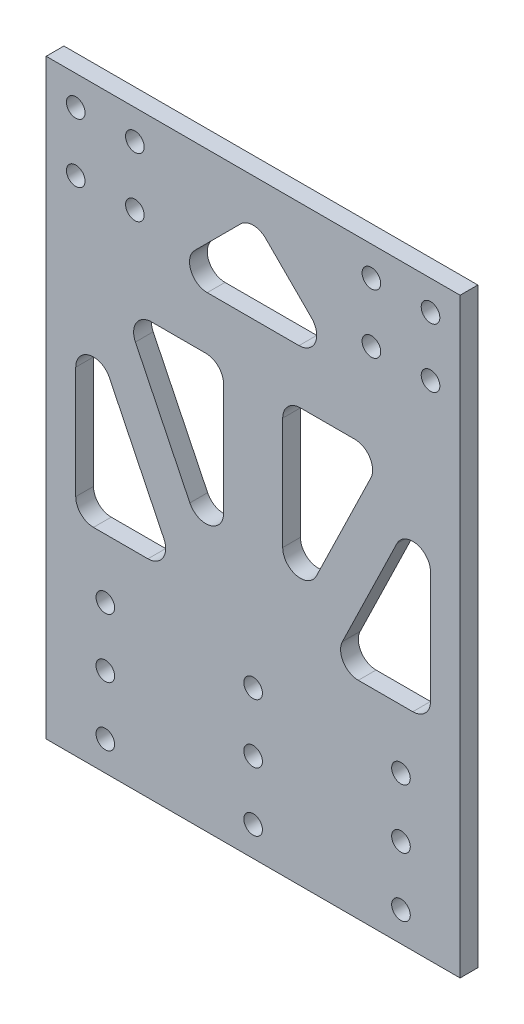
from build123d import *

# Parameters (mm, degrees)
SKETCH_1_W          = 70
SKETCH_1_H          = 100
EXTRUDE_1_DEPTH     = 3
SKETCH_2_R          = 1.575
CUT_EXTRUDE_1_DEPTH = 123.102416029
CUT_EXTRUDE_2_DEPTH = 123.102416029
FILLET_2_R          = 3


with BuildPart() as part:
    # 草图1 → 凸台-拉伸1 (new body)
    with BuildSketch(Plane.XY):
        with Locations((35, -50)):
            Rectangle(SKETCH_1_W, SKETCH_1_H)
    extrude(amount=EXTRUDE_1_DEPTH)

    # 草图2 → 切除-拉伸1 (cut, through all)
    with BuildSketch(Plane.XY.offset(3)):
        with Locations((5, -5)):
            Circle(SKETCH_2_R)
        with Locations(Location((15, -5, 0), (0, 0, 180))):
            Circle(SKETCH_2_R)
        with Locations((15, -15)):
            Circle(SKETCH_2_R)
        with Locations(Location((5, -15, 0), (0, 0, 180))):
            Circle(SKETCH_2_R)
        with Locations((65, -15)):
            Circle(SKETCH_2_R)
        with Locations(Location((55, -15, 0), (0, 0, 180))):
            Circle(SKETCH_2_R)
        with Locations((55, -5)):
            Circle(SKETCH_2_R)
        with Locations(Location((65, -5, 0), (0, 0, 180))):
            Circle(SKETCH_2_R)
        with Locations((10, -85)):
            Circle(SKETCH_2_R)
        with Locations((35, -85)):
            Circle(SKETCH_2_R)
        with Locations(Location((60, -85, 0), (0, 0, 180))):
            Circle(SKETCH_2_R)
        with Locations((60, -75)):
            Circle(SKETCH_2_R)
        with Locations(Location((35, -75, 0), (0, 0, 180))):
            Circle(SKETCH_2_R)
        with Locations(Location((10, -75, 0), (0, 0, 180))):
            Circle(SKETCH_2_R)
        with Locations((10, -95)):
            Circle(SKETCH_2_R)
        with Locations((35, -95)):
            Circle(SKETCH_2_R)
        with Locations(Location((60, -95, 0), (0, 0, 180))):
            Circle(SKETCH_2_R)
    extrude(amount=-CUT_EXTRUDE_1_DEPTH, mode=Mode.SUBTRACT)

    # 草图3 → 切除-拉伸2 (cut, through all)
    with BuildSketch(Plane(origin=(0, 0, 0), x_dir=(-1, 0, 0), z_dir=(0, 0, -1))):
        Polygon((-65, -30), (-65, -65), (-48, -65), align=None)
        Polygon((-57, -30), (-40, -65), (-40, -30), align=None)
        Polygon((-30, -30), (-13, -30), (-30, -65), align=None)
        Polygon((-22, -65), (-5, -30), (-5, -65), align=None)
        Polygon((-35, -6), (-50, -21), (-20, -21), align=None)
    extrude(amount=-CUT_EXTRUDE_2_DEPTH, mode=Mode.SUBTRACT)

    # 圆角2
    fillet_2_edges = [part.edges().sort_by_distance(p)[0] for p in [
        (57, -30, 1.5),
        (40, -30, 1.5),
        (40, -65, 1.5),
        (30, -65, 1.5),
        (30, -30, 1.5),
        (13, -30, 1.5),
        (5, -65, 1.5),
        (22, -65, 1.5),
        (5, -30, 1.5),
        (35, -6, 1.5),
        (20, -21, 1.5),
        (50, -21, 1.5),
        (65, -30, 1.5),
        (48, -65, 1.5),
        (65, -65, 1.5),
    ]]
    fillet(fillet_2_edges, radius=FILLET_2_R)


solid = part.part
